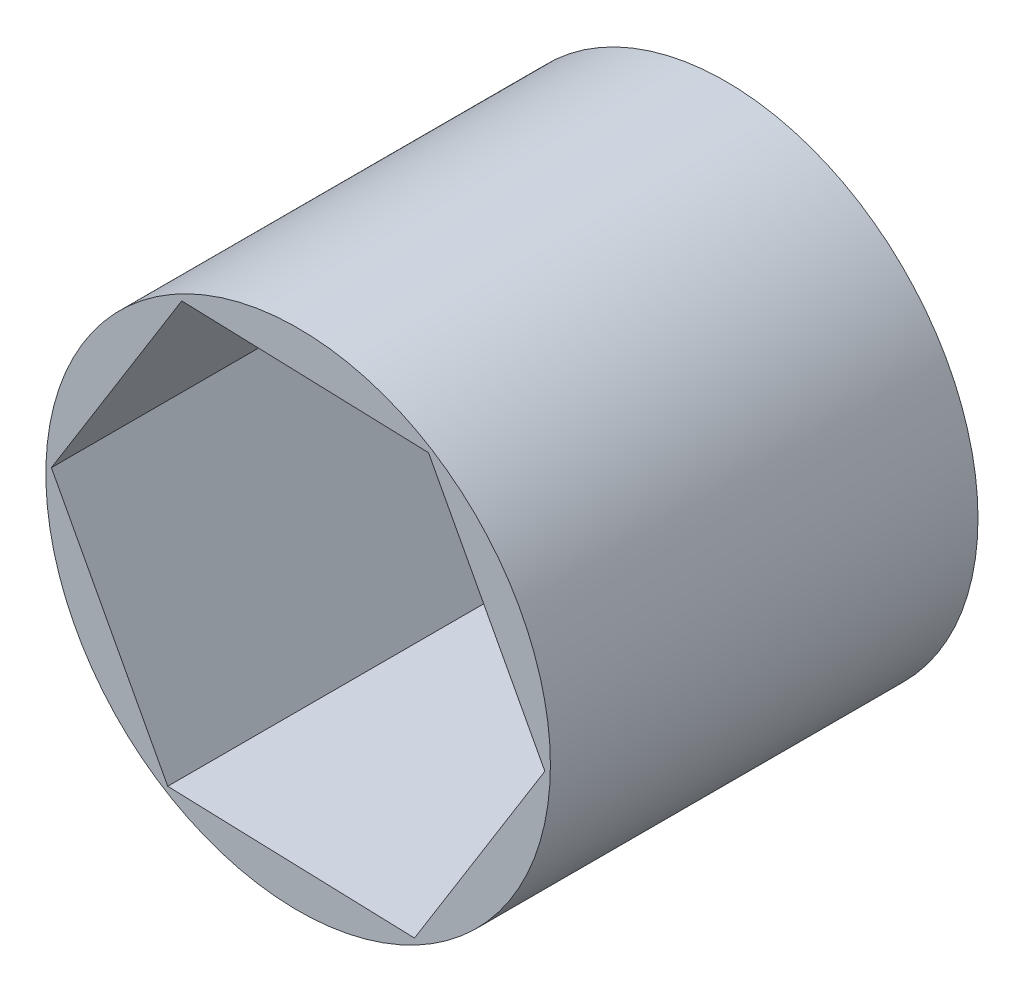
from build123d import *

# Parameters (mm, degrees)
SKETCH1_R           = 7.493
BOSS_EXTRUDE1_DEPTH = 12.7


with BuildPart() as part:
    # Sketch1 → Boss-Extrude1 (new body)
    with BuildSketch(Plane.XY):
        Circle(SKETCH1_R)
        Polygon((3.872477022, 6.226335604), (-3.455926294, 6.466831278), (-7.328403316, 0.240495675), (-3.872477022, -6.226335604), (3.455926294, -6.466831278), (7.328403316, -0.240495675), align=None, mode=Mode.SUBTRACT)
    extrude(amount=BOSS_EXTRUDE1_DEPTH)


solid = part.part
